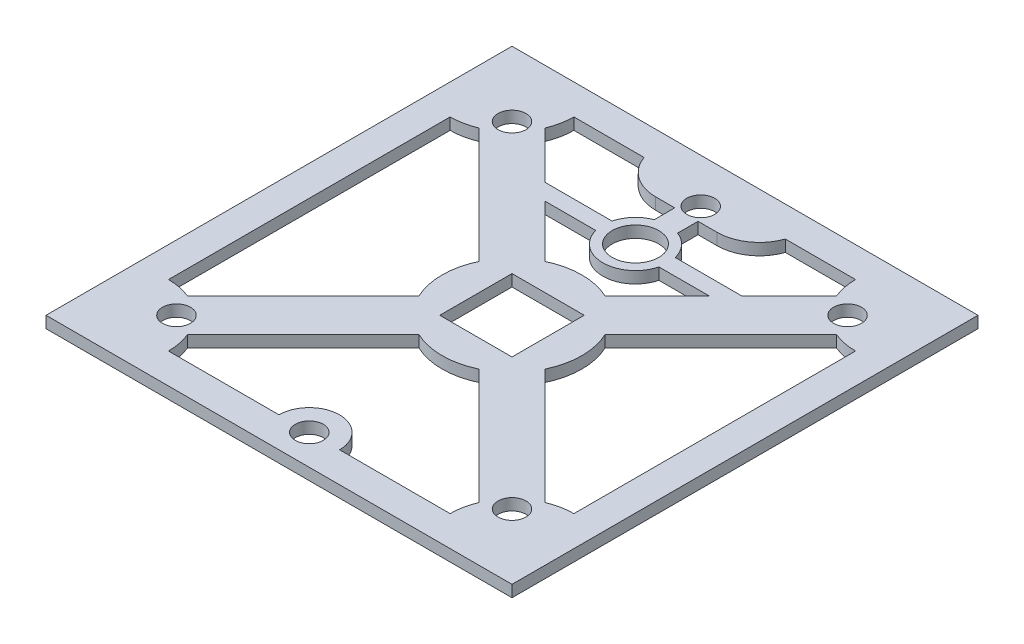
from build123d import *

# Parameters (mm, degrees)
SKETCH1_W           = 100
SKETCH1_H           = 100
BOSS_EXTRUDE1_DEPTH = 2.5
SKETCH5_W           = 87
SKETCH5_H           = 87
CUT_EXTRUDE2_DEPTH  = 4
SKETCH6_R           = 15
BOSS_EXTRUDE3_DEPTH = 2.5
SKETCH7_W           = 15.5
SKETCH7_H           = 15.5
CUT_EXTRUDE3_DEPTH  = 2.5
BOSS_EXTRUDE4_DEPTH = 2.5
EXTRUDE_THIN2_DEPTH = 2.5
SKETCH10_R          = 3
CUT_EXTRUDE5_DEPTH  = 2.5
SKETCH11_R          = 6.5
BOSS_EXTRUDE5_DEPTH = 2.5
SKETCH12_R          = 3
CUT_EXTRUDE6_DEPTH  = 3
SKETCH13_R          = 7
SKETCH13_R_2        = 5
BOSS_EXTRUDE6_DEPTH = 2.5
SKETCH14_W          = 5
SKETCH14_H          = 9
EXTRUDE_THIN5_DEPTH = 2.5
SKETCH15_W          = 17.095160315
SKETCH15_H          = 3.5
EXTRUDE_THIN7_DEPTH = 2.5
BOSS_EXTRUDE8_DEPTH = 2.5
SKETCH20_W          = 31.082582927
SKETCH20_H          = 6.049047595
CUT_EXTRUDE8_DEPTH  = 2.5
SKETCH21_R          = 3
CUT_EXTRUDE9_DEPTH  = 10


with BuildPart() as part:
    # Sketch1 → Boss-Extrude1 (new body)
    with BuildSketch(Plane(origin=(0, 0, 0), x_dir=(1, 0, 0), z_dir=(0, 1, 0))):
        Rectangle(SKETCH1_W, SKETCH1_H)
    extrude(amount=BOSS_EXTRUDE1_DEPTH)

    # Sketch5 → Cut-Extrude2 (cut)
    with BuildSketch(Plane(origin=(0, 2.5, 0), x_dir=(1, 0, 0), z_dir=(0, 1, 0))):
        Rectangle(SKETCH5_W, SKETCH5_H)
    extrude(amount=-CUT_EXTRUDE2_DEPTH, mode=Mode.SUBTRACT)

    # Sketch8 → Boss-Extrude4 (add)
    with BuildSketch(Plane(origin=(0, 2.5, 0), x_dir=(1, 0, 0), z_dir=(0, 1, 0))):
        with BuildLine():
            Line((-43.5, -43.5), (-30.220069463, -43.5))
            ThreePointArc((-30.220069463, -43.5), (-34.109671064, -34.109671064), (-43.5, -30.220069463))
            Line((-43.5, -30.220069463), (-43.5, -43.5))
        make_face()
        with BuildLine():
            ThreePointArc((-43.5, 30.220069463), (-34.109671064, 34.109671064), (-30.220069463, 43.5))
            Line((-30.220069463, 43.5), (-43.5, 43.5))
            Line((-43.5, 43.5), (-43.5, 30.220069463))
        make_face()
        with BuildLine():
            Line((43.5, 43.5), (30.220069463, 43.5))
            ThreePointArc((30.220069463, 43.5), (34.109671064, 34.109671064), (43.5, 30.220069463))
            Line((43.5, 30.220069463), (43.5, 43.5))
        make_face()
        with BuildLine():
            ThreePointArc((43.5, -30.220069463), (34.109671064, -34.109671064), (30.220069463, -43.5))
            Line((30.220069463, -43.5), (43.5, -43.5))
            Line((43.5, -43.5), (43.5, -30.220069463))
        make_face()
    extrude(amount=-BOSS_EXTRUDE4_DEPTH)



with BuildPart() as body_2:
    # Sketch6 → Boss-Extrude3 (new body)
    with BuildSketch(Plane(origin=(0, 2.5, 0), x_dir=(1, 0, 0), z_dir=(0, 1, 0))):
        with Locations(Location((0, 0, 0), (0, 0, 270))):
            Circle(SKETCH6_R)
    extrude(amount=-BOSS_EXTRUDE3_DEPTH)

    # Sketch7 → Cut-Extrude3 (cut)
    with BuildSketch(Plane(origin=(0, 2.5, 0), x_dir=(1, 0, 0), z_dir=(0, 1, 0))):
        Rectangle(SKETCH7_W, SKETCH7_H)
    extrude(amount=-CUT_EXTRUDE3_DEPTH, mode=Mode.SUBTRACT)


with BuildPart() as part_1:
    add(part.part)

    add(body_2.part)  # Extrude-Thin2 merges body 2
    # Sketch9 → Extrude-Thin2 (add)
    with BuildSketch(Plane(origin=(0, 2.5, 0), x_dir=(1, 0, 0), z_dir=(0, 1, 0))):
        Polygon((4.214466094, -11.285533906), (34.46870341, -41.539771222), (41.539771222, -34.46870341), (11.285533906, -4.214466094), align=None)
        Polygon((-11.285533906, -4.214466094), (-41.539771222, -34.46870341), (-34.46870341, -41.539771222), (-4.214466094, -11.285533906), align=None)
        Polygon((11.285533906, 4.214466094), (41.539771222, 34.46870341), (34.46870341, 41.539771222), (4.214466094, 11.285533906), align=None)
        Polygon((-4.214466094, 11.285533906), (-34.46870341, 41.539771222), (-41.539771222, 34.46870341), (-11.285533906, 4.214466094), align=None)
    extrude(amount=-EXTRUDE_THIN2_DEPTH)

    # Sketch10 → Cut-Extrude5 (cut)
    with BuildSketch(Plane(origin=(0, 2.5, 0), x_dir=(1, 0, 0), z_dir=(0, 1, 0))):
        with Locations(Location((36, 36, 0), (0, 0, 270))):
            Circle(SKETCH10_R)
        with Locations(Location((-36, 36, 0), (0, 0, 90))):
            Circle(SKETCH10_R)
        with Locations(Location((36, -36, 0), (0, 0, 90))):
            Circle(SKETCH10_R)
        with Locations(Location((-36, -36, 0), (0, 0, 270))):
            Circle(SKETCH10_R)
    extrude(amount=-CUT_EXTRUDE5_DEPTH, mode=Mode.SUBTRACT)

    # Sketch11 → Boss-Extrude5 (add)
    with BuildSketch(Plane(origin=(0, 2.5, 0), x_dir=(1, 0, 0), z_dir=(0, 1, 0))):
        with Locations((0, -43.5)):
            Circle(SKETCH11_R)
        with Locations((0, 43.5)):
            Circle(SKETCH11_R)
    extrude(amount=-BOSS_EXTRUDE5_DEPTH)

    # Sketch12 → Cut-Extrude6 (cut)
    with BuildSketch(Plane(origin=(0, 2.5, 0), x_dir=(1, 0, 0), z_dir=(0, 1, 0))):
        with Locations(Location((0, 43.5, 0), (0, 0, 270))):
            Circle(SKETCH12_R)
        with Locations(Location((0, -43.5, 0), (0, 0, 270))):
            Circle(SKETCH12_R)
    extrude(amount=-CUT_EXTRUDE6_DEPTH, mode=Mode.SUBTRACT)



with BuildPart() as body_2_2:
    # Sketch13 → Boss-Extrude6 (new body)
    with BuildSketch(Plane(origin=(0, 2.5, 0), x_dir=(1, 0, 0), z_dir=(0, 1, 0))):
        with Locations(Location((0, 26.5, 0), (0, 0, 270))):
            Circle(SKETCH13_R)
        with Locations(Location((0, 26.5, 0), (0, 0, 270))):
            Circle(SKETCH13_R_2, mode=Mode.SUBTRACT)
    extrude(amount=-BOSS_EXTRUDE6_DEPTH)


with BuildPart() as part_2:
    add(part_1.part)

    add(body_2_2.part)  # Extrude-Thin5 merges body 2 2
    # Sketch14 → Extrude-Thin5 (add)
    with BuildSketch(Plane(origin=(0, 0, 0), x_dir=(-1, 0, 0), z_dir=(0, -1, 0))):
        with Locations((0, 36)):
            Rectangle(SKETCH14_W, SKETCH14_H)
    extrude(amount=-EXTRUDE_THIN5_DEPTH)

    # Sketch15 → Extrude-Thin7 (add)
    with BuildSketch(Plane(origin=(0, 0, 0), x_dir=(-1, 0, 0), z_dir=(0, -1, 0))):
        with Locations((-13.979094467, 26.5)):
            Rectangle(SKETCH15_W, SKETCH15_H)
        with Locations((13.979094467, 26.5)):
            Rectangle(SKETCH15_W, SKETCH15_H)
    extrude(amount=-EXTRUDE_THIN7_DEPTH)

    # Sketch17 → Boss-Extrude8 (add)
    with BuildSketch(Plane(origin=(0, 0, 0), x_dir=(-1, 0, 0), z_dir=(0, -1, 0))):
        with BuildLine():
            Line((6.591379734, 37.425929606), (-6.591379734, 37.425929606))
            ThreePointArc((-6.591379734, 37.425929606), (-15.665450128, 46.5), (-6.591379734, 55.574070394))
            Line((-6.591379734, 55.574070394), (6.591379734, 55.574070394))
            ThreePointArc((6.591379734, 55.574070394), (15.665450128, 46.5), (6.591379734, 37.425929606))
        make_face()
    extrude(amount=-BOSS_EXTRUDE8_DEPTH)

    # Sketch20 → Cut-Extrude8 (cut)
    with BuildSketch(Plane(origin=(0, 0, 0), x_dir=(-1, 0, 0), z_dir=(0, -1, 0))):
        with Locations((-0.578009107, 53.024523798)):
            Rectangle(SKETCH20_W, SKETCH20_H)
    extrude(amount=-CUT_EXTRUDE8_DEPTH, mode=Mode.SUBTRACT)

    # Sketch21 → Cut-Extrude9 (cut)
    with BuildSketch(Plane(origin=(0, 0, 0), x_dir=(-1, 0, 0), z_dir=(0, -1, 0))):
        with Locations(Location((0, 40.5, 0), (0, 0, 90))):
            Circle(SKETCH21_R)
    extrude(amount=-CUT_EXTRUDE9_DEPTH, mode=Mode.SUBTRACT)


solid = part_2.part
